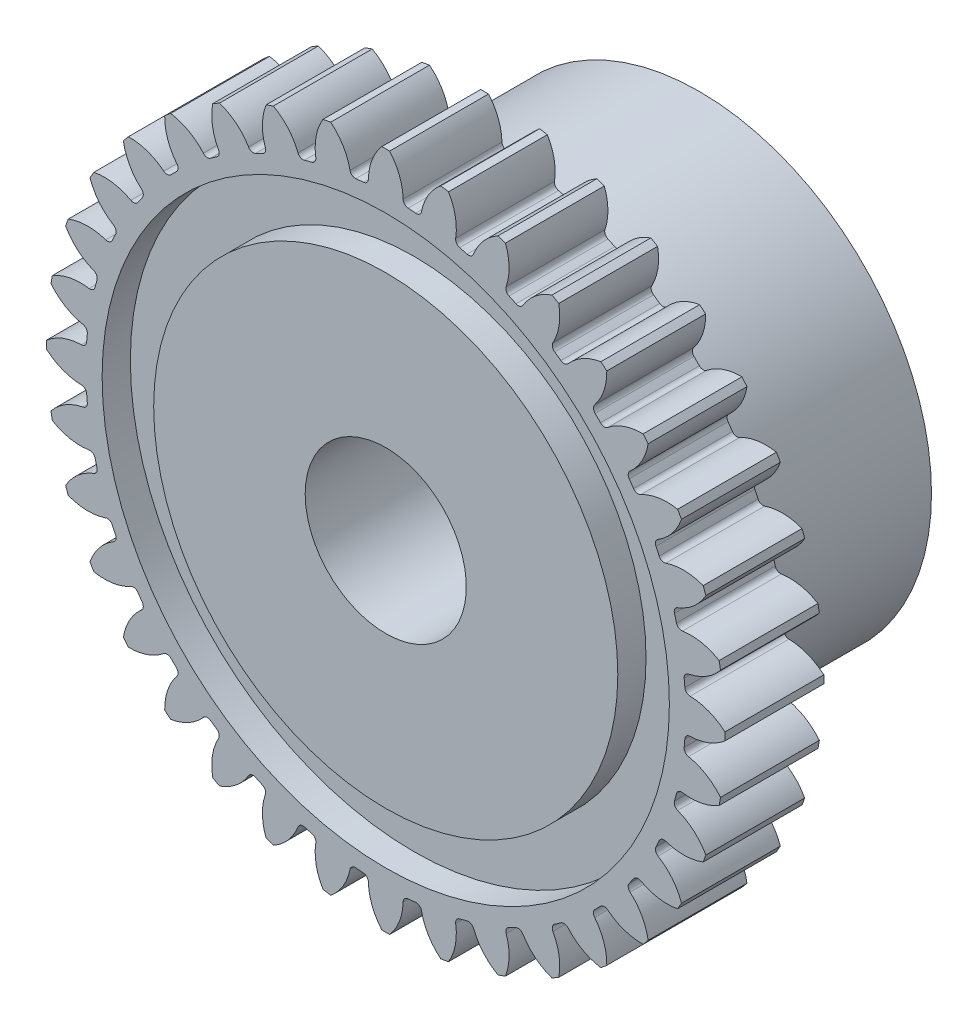
from build123d import *

# Parameters (mm, degrees)
CUT_EXTRUDE1_DEPTH = 17.940879392
CIRPATTERN1_COUNT  = 36


with BuildPart() as part:
    # Sketch3 → Revolve1 (revolve)
    with BuildSketch(Plane(origin=(0, 0, 0), x_dir=(0, 0, -1), z_dir=(1, 0, 0)), mode=Mode.PRIVATE) as revolve1_sk:
        Polygon((-4.6355, 10.026015), (-1.7145, 10.026015), (-1.7145, 8.382), (-2.549071429, 8.382), (-2.549071429, 6.858), (4.6355, 6.858), (4.6355, 2.38125), (-4.6355, 2.38125), (-4.6355, 6.858), (-3.800928571, 6.858), (-3.800928571, 8.382), (-4.6355, 8.382), align=None)
    revolve(revolve1_sk.sketch.rotate(Axis((0, 0, -4.6355), (0, 0, 1)), 90), axis=Axis((0, 0, -4.6355), (0, 0, 1)))

    # Sketch4 → Cut-Extrude1 (cut, symmetric)
    with BuildSketch(Plane.XY.offset(4.6355)):
        with BuildLine():
            ThreePointArc((-0.115554742, 10.025349065), (-0.404870908, 9.544583299), (-0.513113416, 8.994017113))
            ThreePointArc((-0.513113416, 8.994017113), (-0.556576554, 8.888073624), (-0.66000956, 8.838934226))
            ThreePointArc((-0.66000956, 8.838934226), (-0.772508557, 8.829813215), (-0.884882289, 8.819260412))
            ThreePointArc((-0.884882289, 8.819260412), (-0.995276883, 8.849692318), (-1.056476611, 8.946478993))
            ThreePointArc((-1.056476611, 8.946478993), (-1.258679487, 9.469884728), (-1.62708439, 9.893107357))
            ThreePointArc((-1.62708439, 9.893107357), (-0.873824784, 9.987862986), (-0.115554742, 10.025349065))
        make_face()
    cut_extrude1 = extrude(amount=CUT_EXTRUDE1_DEPTH, both=True, mode=Mode.SUBTRACT)

    # CirPattern1: Cut-Extrude1 ×36 about axis
    cirpattern1_axis = Axis((0, 0, 0), (0, 0, 1))
    for i in range(1, CIRPATTERN1_COUNT):
        add(cut_extrude1.rotate(cirpattern1_axis, i * 360 / CIRPATTERN1_COUNT), mode=Mode.SUBTRACT)


solid = part.part
